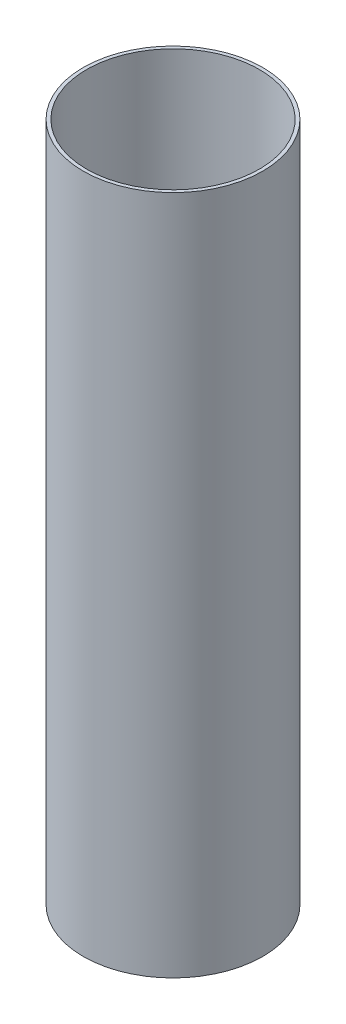
from build123d import *

# Parameters (mm, degrees)
SKETCH1_R           = 39.6
SKETCH1_R_2         = 38.1
BOSS_EXTRUDE1_DEPTH = 300


with BuildPart() as part:
    # Sketch1 → Boss-Extrude1 (new body)
    with BuildSketch(Plane(origin=(0, 0, 0), x_dir=(1, 0, 0), z_dir=(0, 1, 0))):
        with Locations(Location((0, 0, 0), (0, 0, 270))):
            Circle(SKETCH1_R)
        with Locations(Location((0, 0, 0), (0, 0, 270))):
            Circle(SKETCH1_R_2, mode=Mode.SUBTRACT)
    extrude(amount=BOSS_EXTRUDE1_DEPTH)


solid = part.part
